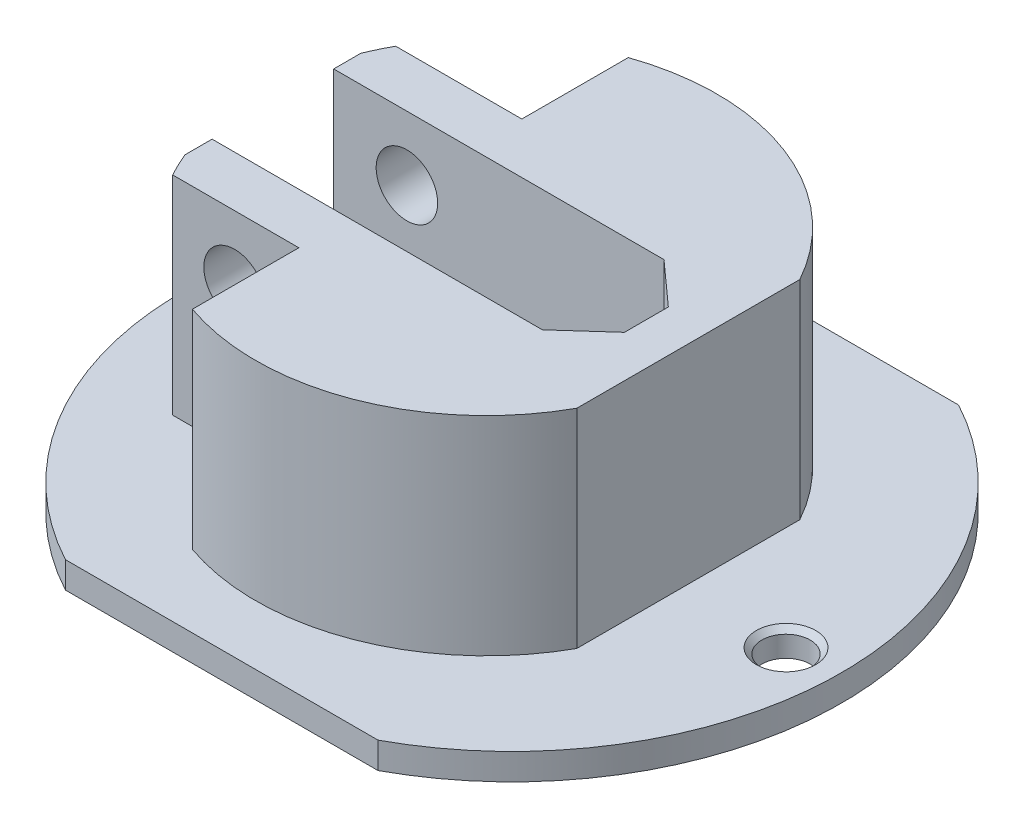
from build123d import *

# Parameters (mm, degrees)
BOSS_EXTRUDE1_DEPTH         = 16
BOSS_EXTRUDE2_DEPTH         = 1.8
M4_TAPPED_HOLE1_AT_2_COUNT  = 2
M4_TAPPED_HOLE1_AT_2_PITCH  = 38.006280301
M5_TAPPED_HOLE1_D           = 4.2
M5_TAPPED_HOLE1_CSINK_D     = 5.05
M5_TAPPED_HOLE1_CSINK_ANGLE = 90
CUT_EXTRUDE1_REACH          = 45.032


with BuildPart() as part:
    # Sketch2 → Boss-Extrude1 (new body)
    with BuildSketch(Plane(origin=(0, 0, 0), x_dir=(1, 0, 0), z_dir=(0, 1, 0))):
        with BuildLine():
            Line((2.56174761, 3.509758774), (-4.43825239, 3.509758774))
            Line((-4.43825239, 3.509758774), (-6.046178238, 3.509758774))
            ThreePointArc((-6.046178238, 3.509758774), (-6.455374166, 2.715838994), (-6.818907741, 1.9))
            Line((-6.818907741, 1.9), (-6.818907741, 0.05))
            Line((-6.818907741, 0.05), (-5.306541861, 0.05))
            Line((-5.306541861, 0.05), (15.777709192, 0.05))
            Line((15.777709192, 0.05), (15.777709192, 0))
            Line((15.777709192, 0), (18.671266747, -2.599889358))
            Line((18.671266747, -2.599889358), (18.671266747, -5.599889358))
            Line((18.671266747, -5.599889358), (15.777709192, -8.199778717))
            Line((15.777709192, -8.199778717), (15.777709192, -8.25))
            Line((15.777709192, -8.25), (-5.306541861, -8.25))
            Line((-5.306541861, -8.25), (-6.818907741, -8.25))
            Line((-6.818907741, -8.25), (-6.818907741, -10.1))
            ThreePointArc((-6.818907741, -10.1), (-6.455374166, -10.915838994), (-6.046178238, -11.709758774))
            Line((-6.046178238, -11.709758774), (-4.43825239, -11.709758774))
            Line((-4.43825239, -11.709758774), (2.56174761, -11.709758774))
            Line((2.56174761, -11.709758774), (2.56174761, -17.495983577))
            Line((2.56174761, -17.495983577), (2.56174761, -18.97321001))
            ThreePointArc((2.56174761, -18.97321001), (13.37493466, -18.80880594), (21.533094515, -11.709758774))
            Line((21.533094515, -11.709758774), (21.533094515, 3.509758774))
            ThreePointArc((21.533094515, 3.509758774), (13.37493466, 10.60880594), (2.56174761, 10.77321001))
            Line((2.56174761, 10.77321001), (2.56174761, 9.295983577))
            Line((2.56174761, 9.295983577), (2.56174761, 3.509758774))
        make_face()
    extrude(amount=BOSS_EXTRUDE1_DEPTH)

    # Sketch4 → Boss-Extrude2 (add)
    with BuildSketch(Plane(origin=(0, 0, 0), x_dir=(1, 0, 0), z_dir=(0, 1, 0))):
        with BuildLine():
            Line((-1.167494267, 15.710466074), (20.167494267, 15.710466074))
            ThreePointArc((20.167494267, 15.710466074), (32, -4.1), (20.167494267, -23.910466074))
            Line((20.167494267, -23.910466074), (-1.167494267, -23.910466074))
            ThreePointArc((-1.167494267, -23.910466074), (-13, -4.1), (-1.167494267, 15.710466074))
        make_face()
    extrude(amount=BOSS_EXTRUDE2_DEPTH)

    # Sketch8 → M4 Tapped Hole1 (revolve, cut)
    with BuildSketch(Plane(origin=(28.620732779, 1.8, 4.51846258), x_dir=(0, 0, 1), z_dir=(1, 0, 0))):
        Polygon((0, 0), (0, 1.8), (1.65, 1.8), (1.65, 0.375), (2.025, 0), align=None)
    m4_tapped_hole1 = revolve(axis=Axis((28.620732779, 8.15, 4.51846258), (0, -1, 0)), mode=Mode.SUBTRACT)

    # M4 Tapped Hole1 at 2: M4 Tapped Hole1 ×2
    with Locations(*[Vector(-0.9999991610523592, 0, -0.001295335700845017) * (i * M4_TAPPED_HOLE1_AT_2_PITCH) for i in range(1, M4_TAPPED_HOLE1_AT_2_COUNT)]):
        add(m4_tapped_hole1, mode=Mode.SUBTRACT)

    # M5 Tapped Hole1 (through all)
    with Locations(Plane(origin=(0, 0, -10.05), x_dir=(1, 0, 0), z_dir=(0, 0, -1))):
        with Locations((-1.823787651, -11.616172117)):
            CounterSinkHole(M5_TAPPED_HOLE1_D / 2, M5_TAPPED_HOLE1_CSINK_D / 2, counter_sink_angle=M5_TAPPED_HOLE1_CSINK_ANGLE)

    # Sketch25 → Cut-Extrude1 (cut, up to next)
    with BuildSketch(Plane(origin=(0, 16, 0), x_dir=(1, 0, 0), z_dir=(0, 1, 0)), mode=Mode.PRIVATE) as cut_extrude1_sk1:
        Polygon((15.777709192, 0), (18.671266747, -2.599889358), (18.671266747, -5.599889358), (15.777709192, -8.199778717), (15.777709192, -8.25), (2.821266747, -8.25), (2.821266747, 0.05), (15.777709192, 0.05), align=None)
    cut_extrude1_tool1 = extrude(cut_extrude1_sk1.sketch, amount=-CUT_EXTRUDE1_REACH, mode=Mode.PRIVATE) & part.part
    add(cut_extrude1_tool1.solids().sort_by_distance((10.307921, 16, 4.099986))[0], mode=Mode.SUBTRACT)


solid = part.part
